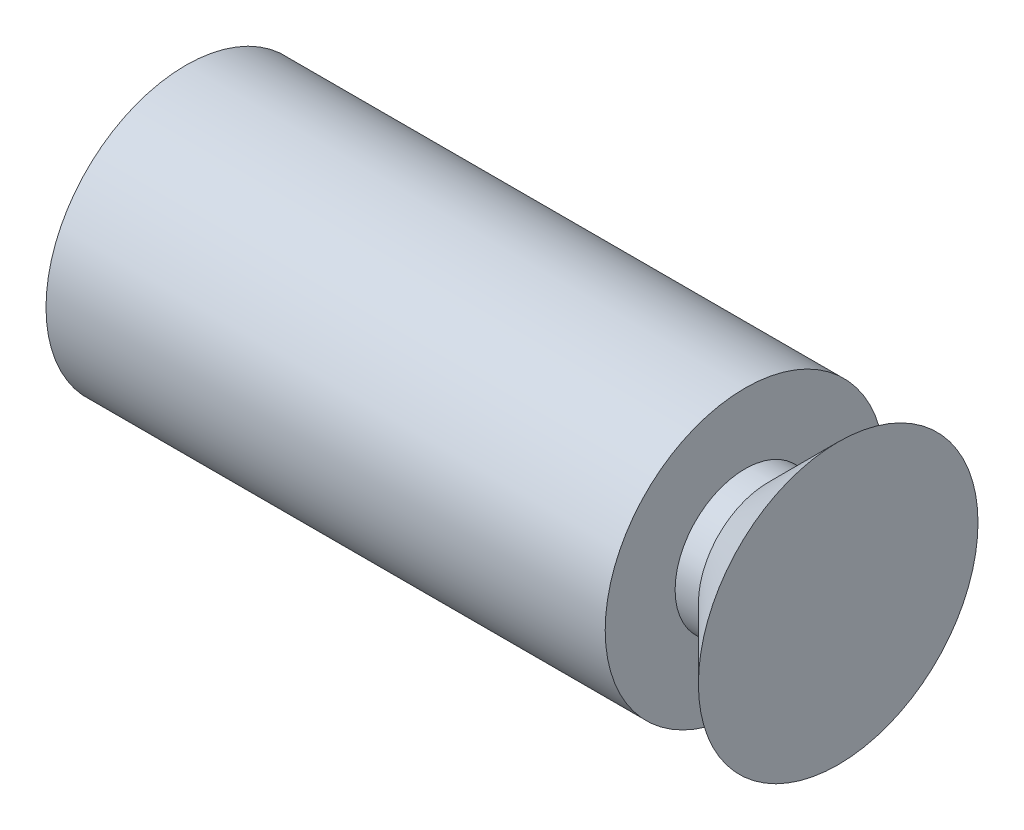
from build123d import *


with BuildPart() as part:
    # Эскиз1 → Revolve 409 (revolve)
    with BuildSketch(Plane.XY, mode=Mode.PRIVATE) as revolve_409_sk:
        Polygon((5.5, 0), (5.5, -3), (4, -1.5), (3.5, -1.5), (3.5, -3), (-8.5, -3), (-8.5, -1.2), (-0.5, -1.2), (0.3, 0), align=None)
    revolve(revolve_409_sk.sketch.rotate(Axis((-97.089355169, 0, 0), (1, 0, 0)), 270), axis=Axis((-97.089355169, 0, 0), (1, 0, 0)))


solid = part.part
